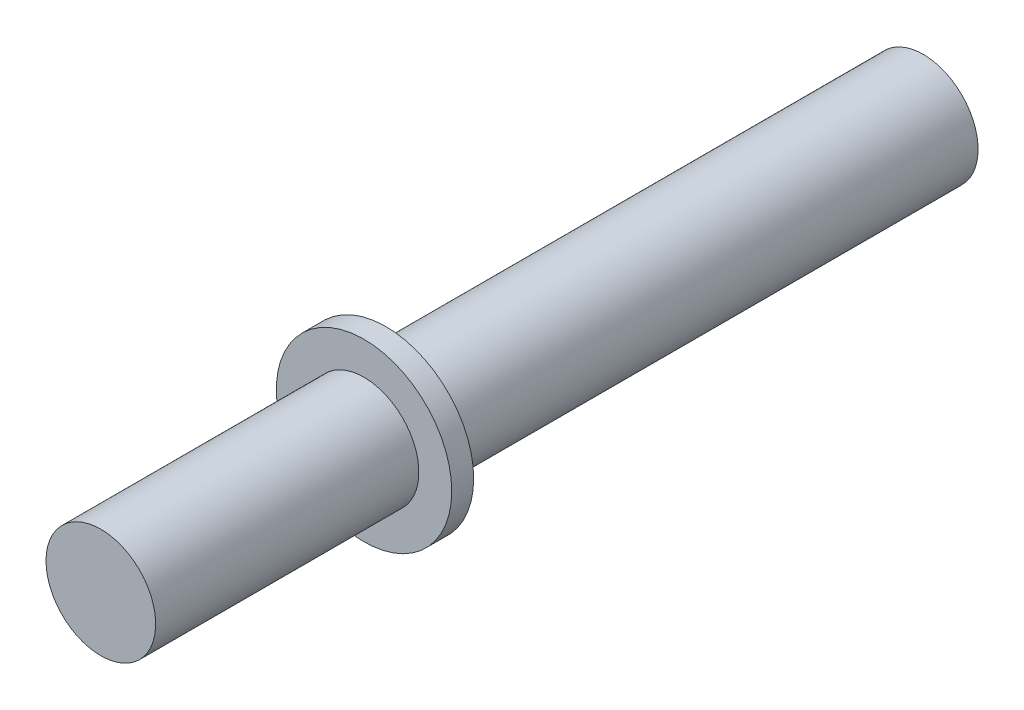
from build123d import *

# Parameters (mm, degrees)
PLUNGER_STEM_START     = 21.5
SKETCH1_R              = 1.5
PLUNGER_STEM_DEPTH     = 22.5
CAPTIVE_SHOULDER_START = 36.2
SKETCH2_R              = 2.4
CAPTIVE_SHOULDER_DEPTH = 0.6


with BuildPart() as part:
    # Sketch1 → Plunger_stem (new body)
    with BuildSketch(Plane.XY.offset(PLUNGER_STEM_START)):
        with Locations(Location((-32.018684277, -34.643402341, 0), (0, 0, 180))):
            Circle(SKETCH1_R)
    extrude(amount=PLUNGER_STEM_DEPTH)

    # Sketch2 → Captive_shoulder (add)
    with BuildSketch(Plane.XY.offset(CAPTIVE_SHOULDER_START)):
        with Locations((-32.018684277, -34.643402341)):
            Circle(SKETCH2_R)
    extrude(amount=CAPTIVE_SHOULDER_DEPTH)


solid = part.part
